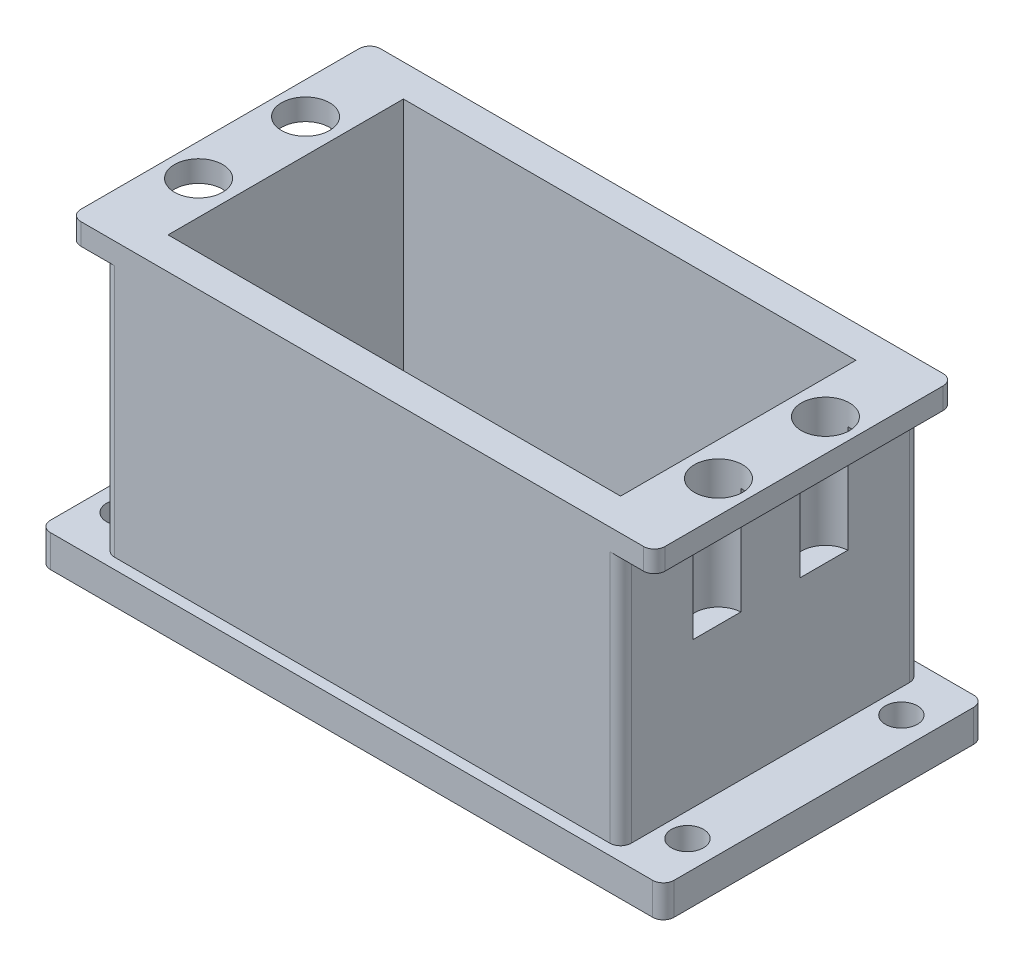
from build123d import *

# Parameters (mm, degrees)
SKETCH1_W           = 48.3
SKETCH1_H           = 28
SKETCH1_W_2         = 42.3
SKETCH1_H_2         = 22
BOSS_EXTRUDE1_DEPTH = 26.6
SKETCH2_W           = 54.6
SKETCH2_H           = 28
SKETCH2_W_2         = 42.3
SKETCH2_H_2         = 22
BOSS_EXTRUDE2_DEPTH = 2
SKETCH4_R           = 2.25
CUT_EXTRUDE1_DEPTH  = 12
SKETCH5_W           = 58.3
SKETCH5_H           = 30
SKETCH5_W_2         = 48.3
SKETCH5_H_2         = 28
BOSS_EXTRUDE3_DEPTH = 3
SKETCH6_W           = 10
SKETCH6_H           = 24
CUT_EXTRUDE2_DEPTH  = 10
SKETCH7_R           = 1.5
CUT_EXTRUDE3_DEPTH  = 10
FILLET1_R           = 1
FILLET2_R           = 1
FILLET3_R           = 1


with BuildPart() as part:
    # Sketch1 → Boss-Extrude1 (new body)
    with BuildSketch(Plane(origin=(0, 0, 0), x_dir=(1, 0, 0), z_dir=(0, 1, 0))):
        Rectangle(SKETCH1_W, SKETCH1_H)
        Rectangle(SKETCH1_W_2, SKETCH1_H_2, mode=Mode.SUBTRACT)
    extrude(amount=BOSS_EXTRUDE1_DEPTH)

    # Sketch2 → Boss-Extrude2 (add)
    with BuildSketch(Plane(origin=(0, 26.6, 0), x_dir=(1, 0, 0), z_dir=(0, 1, 0))):
        Rectangle(SKETCH2_W, SKETCH2_H)
        Rectangle(SKETCH2_W_2, SKETCH2_H_2, mode=Mode.SUBTRACT)
    extrude(amount=BOSS_EXTRUDE2_DEPTH)

    # Sketch4 → Cut-Extrude1 (cut)
    with BuildSketch(Plane(origin=(0, 28.6, 0), x_dir=(1, 0, 0), z_dir=(0, 1, 0))):
        with Locations(Location((-24.3, 5, 0), (0, 0, 270))):
            Circle(SKETCH4_R)
        with Locations(Location((-24.3, -5, 0), (0, 0, 270))):
            Circle(SKETCH4_R)
        with Locations(Location((24.3, 5, 0), (0, 0, 270))):
            Circle(SKETCH4_R)
        with Locations(Location((24.3, -5, 0), (0, 0, 270))):
            Circle(SKETCH4_R)
    extrude(amount=-CUT_EXTRUDE1_DEPTH, mode=Mode.SUBTRACT)

    # Sketch5 → Boss-Extrude3 (add)
    with BuildSketch(Plane.XZ):
        Rectangle(SKETCH5_W, SKETCH5_H)
        Rectangle(SKETCH5_W_2, SKETCH5_H_2, mode=Mode.SUBTRACT)
    extrude(amount=-BOSS_EXTRUDE3_DEPTH)

    # Sketch6 → Cut-Extrude2 (cut)
    with BuildSketch(Plane.ZY.offset(29.15)):
        Rectangle(SKETCH6_W, SKETCH6_H)
    extrude(amount=-CUT_EXTRUDE2_DEPTH, mode=Mode.SUBTRACT)

    # Sketch7 → Cut-Extrude3 (cut)
    with BuildSketch(Plane.XZ):
        with Locations(Location((-26.4, 10, 0), (0, 0, 270))):
            Circle(SKETCH7_R)
        with Locations(Location((-26.4, -10, 0), (0, 0, 270))):
            Circle(SKETCH7_R)
        with Locations(Location((26.4, 10, 0), (0, 0, 270))):
            Circle(SKETCH7_R)
        with Locations(Location((26.4, -10, 0), (0, 0, 270))):
            Circle(SKETCH7_R)
    extrude(amount=-CUT_EXTRUDE3_DEPTH, mode=Mode.SUBTRACT)

    # Fillet1
    fillet1_edges = [part.edges().sort_by_distance(p)[0] for p in [
        (-24.15, 14.8, -14),
        (24.15, 14.8, -14),
        (24.15, 14.8, 14),
        (-24.15, 14.8, 14),
    ]]
    fillet(fillet1_edges, radius=FILLET1_R)

    # Fillet2
    fillet2_edges = [part.edges().sort_by_distance(p)[0] for p in [
        (-29.15, 1.5, 5),
        (-29.15, 1.5, -5),
        (27.3, 27.6, 14),
        (27.3, 27.6, -14),
        (-27.3, 27.6, -14),
        (-27.3, 27.6, 14),
        (29.15, 1.5, 15),
        (29.15, 1.5, -15),
        (-29.15, 1.5, -15),
        (-29.15, 1.5, 15),
    ]]
    fillet(fillet2_edges, radius=FILLET2_R)

    # Fillet3
    fillet3_edges = [part.edges().sort_by_distance(p)[0] for p in [
        (-22.65, 12, -5),
        (-22.65, 12, 5),
    ]]
    fillet(fillet3_edges, radius=FILLET3_R)


solid = part.part
